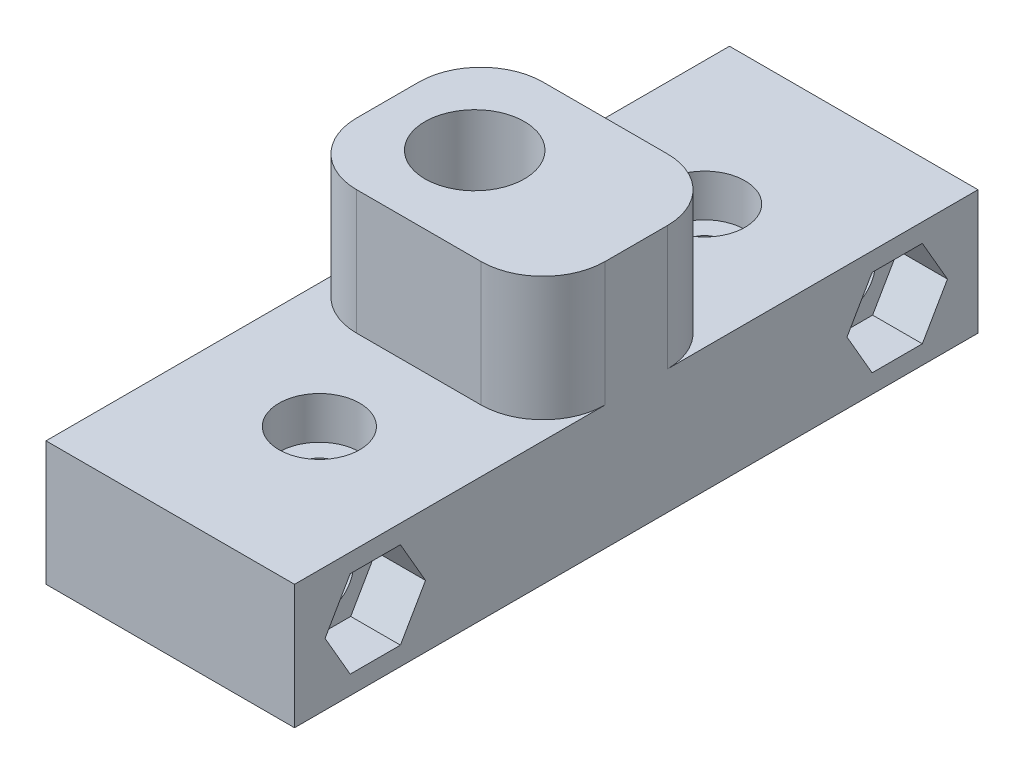
from build123d import *

# Parameters (mm, degrees)
SKETCH1_W                                           = 20
SKETCH1_H                                           = 55
BOSS_EXTRUDE1_DEPTH                                 = 20
SKETCH2_R                                           = 4
CUT_EXTRUDE1_DEPTH                                  = 10
SKETCH3_W                                           = 20
SKETCH3_H                                           = 20
CUT_EXTRUDE2_DEPTH                                  = 10
CBORE_FOR_M3_HEX_SOCKET_HEAD_CAP_SCREW1_D           = 3.4
CBORE_FOR_M3_HEX_SOCKET_HEAD_CAP_SCREW1_CBORE_D     = 6.5
CBORE_FOR_M3_HEX_SOCKET_HEAD_CAP_SCREW1_CBORE_DEPTH = 3.4
FILLET2_R                                           = 5
SKETCH9_R                                           = 2.25
CUT_EXTRUDE5_DEPTH                                  = 40.449334595
CUT_EXTRUDE6_DEPTH                                  = 4


with BuildPart() as part:
    # Sketch1 → Boss-Extrude1 (new body)
    with BuildSketch(Plane(origin=(0, 0, 0), x_dir=(1, 0, 0), z_dir=(0, 1, 0))):
        Rectangle(SKETCH1_W, SKETCH1_H)
    extrude(amount=BOSS_EXTRUDE1_DEPTH)

    # Sketch2 → Cut-Extrude1 (cut)
    with BuildSketch(Plane(origin=(0, 20, 0), x_dir=(1, 0, 0), z_dir=(0, 1, 0))):
        with Locations(Location((-3, 0, 0), (0, 0, 270))):
            Circle(SKETCH2_R)
    extrude(amount=-CUT_EXTRUDE1_DEPTH, mode=Mode.SUBTRACT)

    # Sketch3 → Cut-Extrude2 (cut)
    with BuildSketch(Plane(origin=(0, 20, 0), x_dir=(1, 0, 0), z_dir=(0, 1, 0))):
        with Locations((0, -17.5)):
            Rectangle(SKETCH3_W, SKETCH3_H)
        with Locations((0, 17.5)):
            Rectangle(SKETCH3_W, SKETCH3_H)
    extrude(amount=-CUT_EXTRUDE2_DEPTH, mode=Mode.SUBTRACT)

    # CBORE for M3 Hex Socket Head Cap Screw1 (through all)
    with Locations(Plane(origin=(0, 10, 0), x_dir=(1, 0, 0), z_dir=(0, 1, 0))):
        with Locations((0, -15.5), (0, 15.5)):
            CounterBoreHole(CBORE_FOR_M3_HEX_SOCKET_HEAD_CAP_SCREW1_D / 2, CBORE_FOR_M3_HEX_SOCKET_HEAD_CAP_SCREW1_CBORE_D / 2, CBORE_FOR_M3_HEX_SOCKET_HEAD_CAP_SCREW1_CBORE_DEPTH)

    # Fillet2
    fillet2_edges = [part.edges().sort_by_distance(p)[0] for p in [
        (-10, 15, 7.5),
        (10, 15, 7.5),
        (-10, 15, -7.5),
        (10, 15, -7.5),
    ]]
    fillet(fillet2_edges, radius=FILLET2_R)

    # Sketch9 → Cut-Extrude5 (cut, through all)
    with BuildSketch(Plane.ZY.offset(10)):
        with Locations((-21, 5)):
            Circle(SKETCH9_R)
        with Locations((21, 5)):
            Circle(SKETCH9_R)
    extrude(amount=-CUT_EXTRUDE5_DEPTH, mode=Mode.SUBTRACT)

    # Sketch10 → Cut-Extrude6 (cut)
    with BuildSketch(Plane(origin=(10, 0, 0), x_dir=(0, 0, -1), z_dir=(1, 0, 0))):
        Polygon((-16.958548116, 5), (-18.979274058, 8.5), (-23.020725942, 8.5), (-25.041451884, 5), (-23.020725942, 1.5), (-18.979274058, 1.5), align=None)
        Polygon((16.958548116, 5), (18.979274058, 1.5), (23.020725942, 1.5), (25.041451884, 5), (23.020725942, 8.5), (18.979274058, 8.5), align=None)
    extrude(amount=-CUT_EXTRUDE6_DEPTH, mode=Mode.SUBTRACT)


solid = part.part
